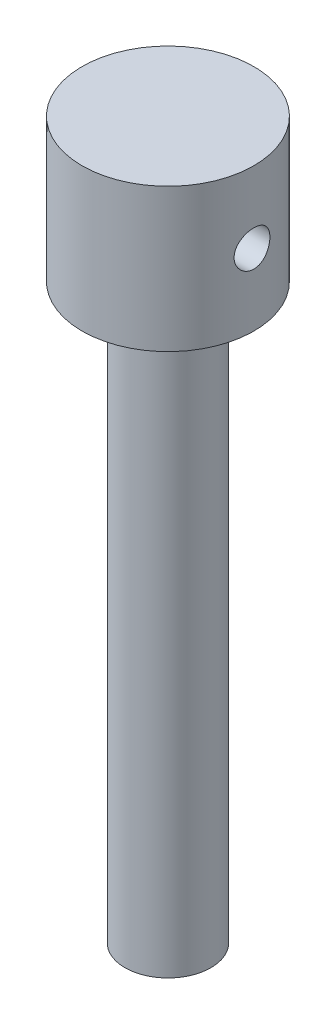
from build123d import *

# Parameters (mm, degrees)
SKETCH2_R               = 6
BOSS_EXTRUDE1_DEPTH     = 80
SKETCH3_R               = 12
BOSS_EXTRUDE2_DEPTH     = 20
CUT_EXTRUDE1_DEPTH      = 102.429778665
CUT_EXTRUDE1_DEPTH_BACK = 102.429778665
SKETCH4_R               = 2.5


with BuildPart() as part:
    # Sketch2 → Boss-Extrude1 (new body)
    with BuildSketch(Plane(origin=(0, 0, 0), x_dir=(1, 0, 0), z_dir=(0, 1, 0))):
        with Locations(Location((0, 0, 0), (0, 0, 270))):
            Circle(SKETCH2_R)
    extrude(amount=BOSS_EXTRUDE1_DEPTH)

    # Sketch3 → Boss-Extrude2 (add)
    with BuildSketch(Plane(origin=(0, 80, 0), x_dir=(1, 0, 0), z_dir=(0, 1, 0))):
        with Locations(Location((0, 0, 0), (0, 0, 270))):
            Circle(SKETCH3_R)
    extrude(amount=BOSS_EXTRUDE2_DEPTH)

    # Sketch4 → Cut-Extrude1 (cut, two sides: drawn at the far end of the back side and taken through both)
    with BuildSketch(Plane(origin=(0, 0, 0), x_dir=(0, 0, -1), z_dir=(1, 0, 0)).offset(-CUT_EXTRUDE1_DEPTH_BACK)):
        with Locations((0, 90)):
            Circle(SKETCH4_R)
    extrude(amount=CUT_EXTRUDE1_DEPTH + CUT_EXTRUDE1_DEPTH_BACK, mode=Mode.SUBTRACT)


solid = part.part
